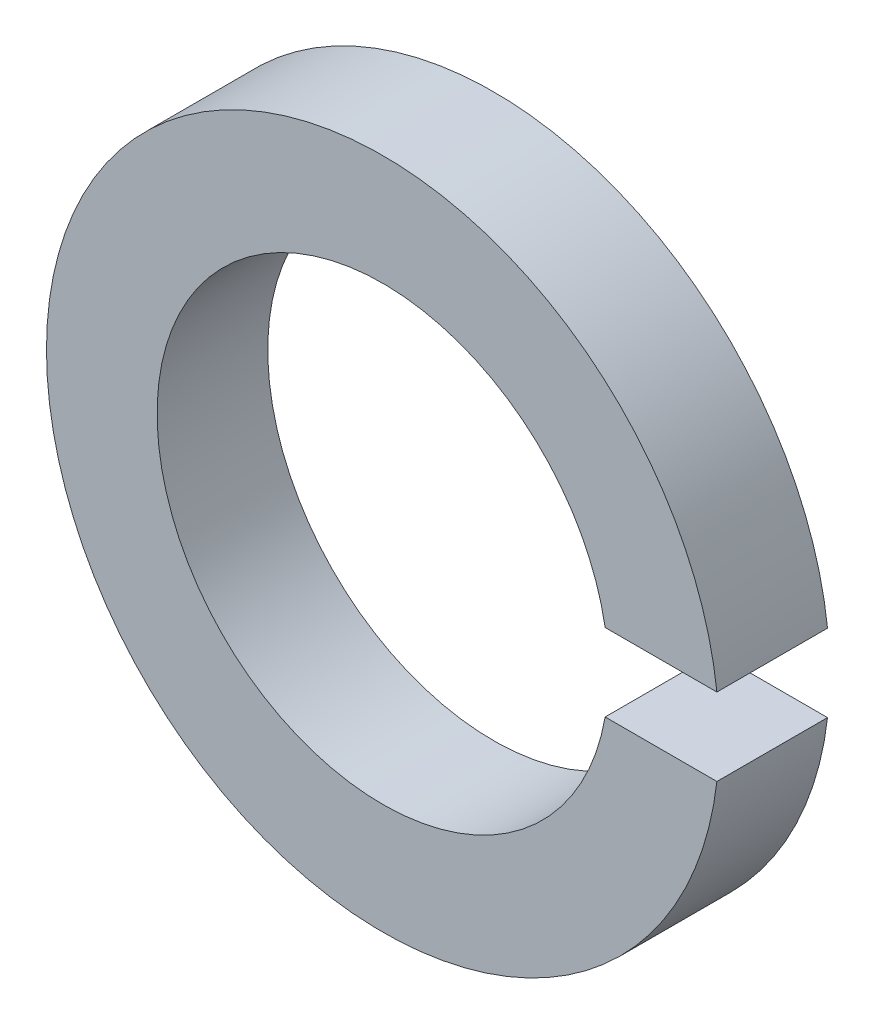
from build123d import *

# Parameters (mm, degrees)
SKETCH_1_R          = 7.6
SKETCH_1_R_2        = 5.1
EXTRUDE_1_DEPTH     = 2.5
SKETCH_2_W          = 2.905503913
SKETCH_2_H          = 1.75
CUT_EXTRUDE_1_DEPTH = 12.034944495


with BuildPart() as part:
    # Эскиз1 → Вытянуть1 (new body)
    with BuildSketch(Plane.XY):
        Circle(SKETCH_1_R)
        Circle(SKETCH_1_R_2, mode=Mode.SUBTRACT)
    extrude(amount=EXTRUDE_1_DEPTH)

    # Эскиз2 → Вырез-Вытянуть1 (cut, through all)
    with BuildSketch(Plane.XY.offset(2.5)):
        with Locations((6.383821586, 0)):
            Rectangle(SKETCH_2_W, SKETCH_2_H)
    extrude(amount=-CUT_EXTRUDE_1_DEPTH, mode=Mode.SUBTRACT)


solid = part.part
